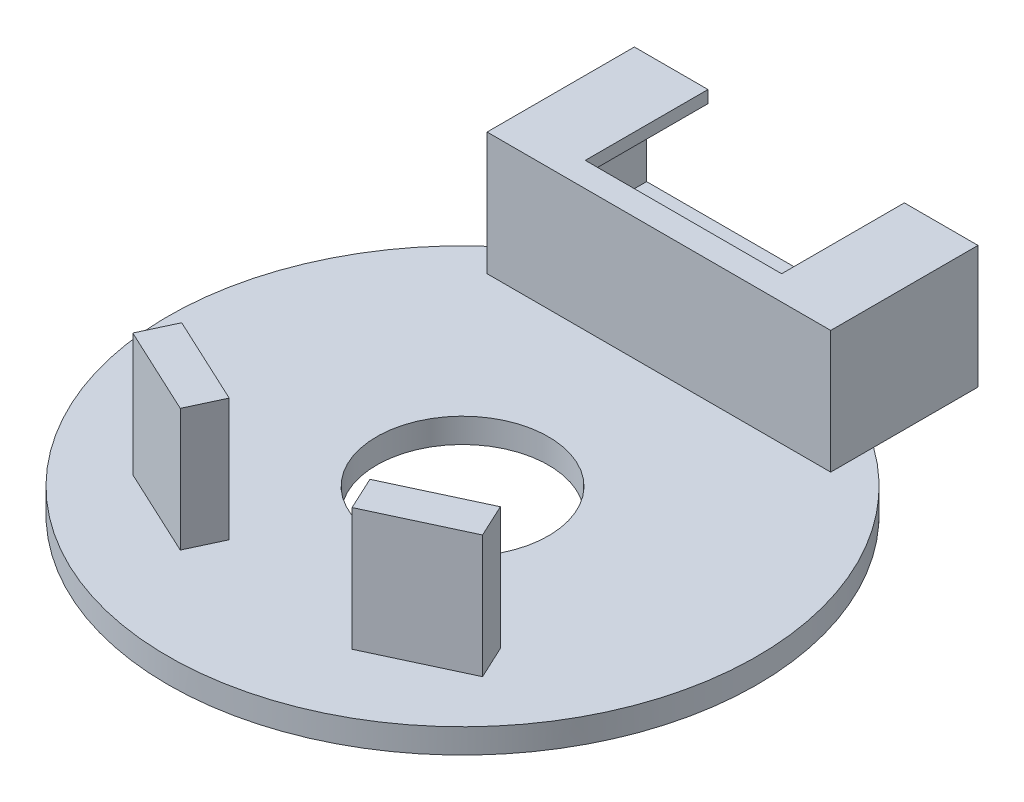
from build123d import *

# Parameters (mm, degrees)
SKETCH1_R           = 12
SKETCH1_R_2         = 3.5
BOSS_EXTRUDE1_DEPTH = 0.5
SKETCH2_W           = 14
SKETCH2_H           = 6
BOSS_EXTRUDE2_DEPTH = 5
SKETCH3_W           = 13
SKETCH3_H           = 4
CUT_EXTRUDE1_DEPTH  = 5
SKETCH4_W           = 8
SKETCH4_H           = 5
CUT_EXTRUDE2_DEPTH  = 4.5
BOSS_EXTRUDE3_DEPTH = 5


with BuildPart() as part:
    # Sketch1 → Boss-Extrude1 (new, symmetric)
    with BuildSketch(Plane(origin=(0, 0, 0), x_dir=(1, 0, 0), z_dir=(0, 1, 0))):
        with Locations(Location((0, 0, 0), (0, 0, 270))):
            Circle(SKETCH1_R)
        with Locations(Location((0, 0, 0), (0, 0, 270))):
            Circle(SKETCH1_R_2, mode=Mode.SUBTRACT)
    extrude(amount=BOSS_EXTRUDE1_DEPTH, both=True)

    # Sketch2 → Boss-Extrude2 (add)
    with BuildSketch(Plane(origin=(0, 0.5, 0), x_dir=(1, 0, 0), z_dir=(0, 1, 0))):
        with Locations((0, 11)):
            Rectangle(SKETCH2_W, SKETCH2_H)
    extrude(amount=BOSS_EXTRUDE2_DEPTH)

    # Sketch3 → Cut-Extrude1 (cut)
    with BuildSketch(Plane(origin=(0, 0, -14), x_dir=(-1, 0, 0), z_dir=(0, 0, -1))):
        with Locations((0, 3)):
            Rectangle(SKETCH3_W, SKETCH3_H)
    extrude(amount=-CUT_EXTRUDE1_DEPTH, mode=Mode.SUBTRACT)

    # Sketch4 → Cut-Extrude2 (cut)
    with BuildSketch(Plane(origin=(0, 5.5, 0), x_dir=(1, 0, 0), z_dir=(0, 1, 0))):
        with Locations((0, 11.5)):
            Rectangle(SKETCH4_W, SKETCH4_H)
    extrude(amount=-CUT_EXTRUDE2_DEPTH, mode=Mode.SUBTRACT)

    # Sketch5 → Boss-Extrude3 (add)
    with BuildSketch(Plane(origin=(0, 0.5, 0), x_dir=(1, 0, 0), z_dir=(0, 1, 0))):
        Polygon((-6.491303756, -4.950065272), (-2.866072607, -6.640538319), (-3.5, -8), (-7.125231148, -6.309526953), align=None)
        Polygon((7.125231148, -6.309526953), (6.491303756, -4.950065272), (2.866072607, -6.640538319), (3.5, -8), align=None)
    extrude(amount=BOSS_EXTRUDE3_DEPTH)


solid = part.part
